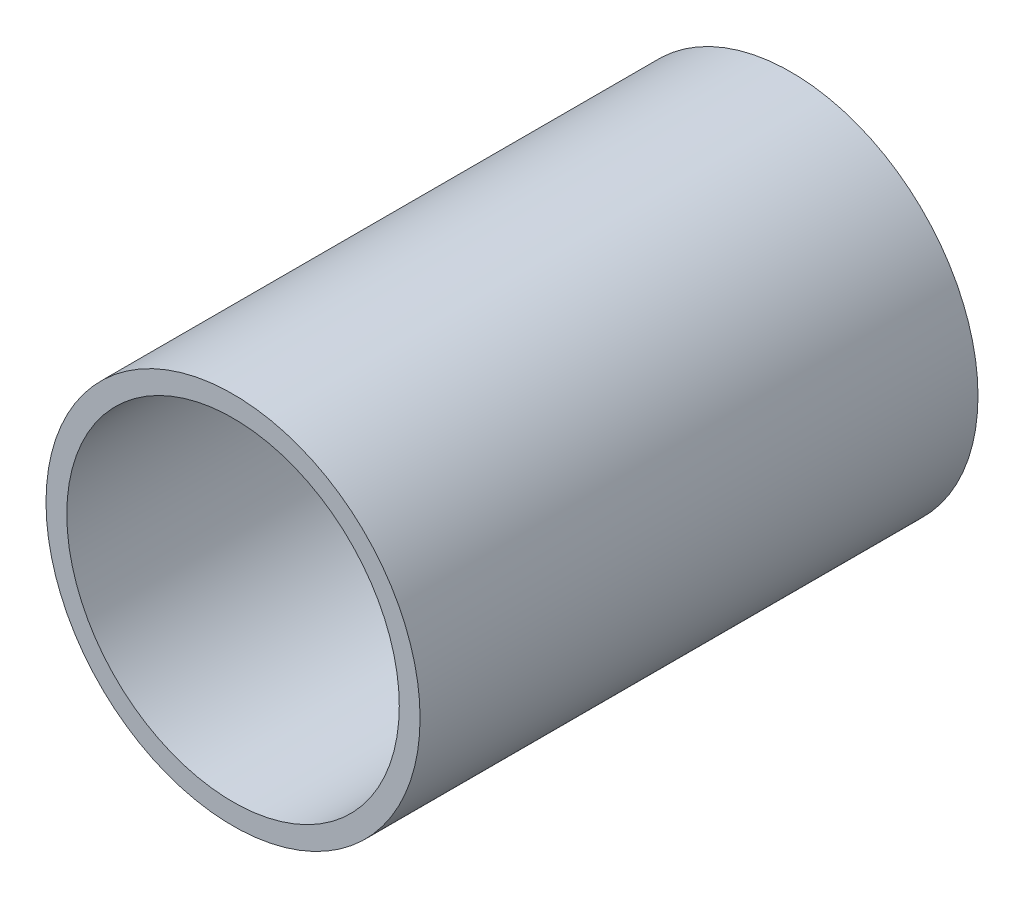
from build123d import *

# Parameters (mm, degrees)
BOSS_EXTRUDE1_DEPTH      = 152.4
BOSS_EXTRUDE1_DEPTH_BACK = 152.4
SKETCH3_R                = 28.575
SKETCH3_R_2              = 25.4
SKETCH4_R                = 28.575
CUT_EXTRUDE1_DEPTH       = 219.56


with BuildPart() as part:
    # Sketch3 → Boss-Extrude1 (new, two sides: drawn at the far end of the back side and taken through both)
    with BuildSketch(Plane.XY.offset(-BOSS_EXTRUDE1_DEPTH_BACK)):
        Circle(SKETCH3_R)
        Circle(SKETCH3_R_2, mode=Mode.SUBTRACT)
    extrude(amount=BOSS_EXTRUDE1_DEPTH + BOSS_EXTRUDE1_DEPTH_BACK)

    # Sketch4 → Cut-Extrude1 (cut)
    with BuildSketch(Plane.XY.offset(152.4)):
        Circle(SKETCH4_R)
    extrude(amount=-CUT_EXTRUDE1_DEPTH, mode=Mode.SUBTRACT)


solid = part.part
